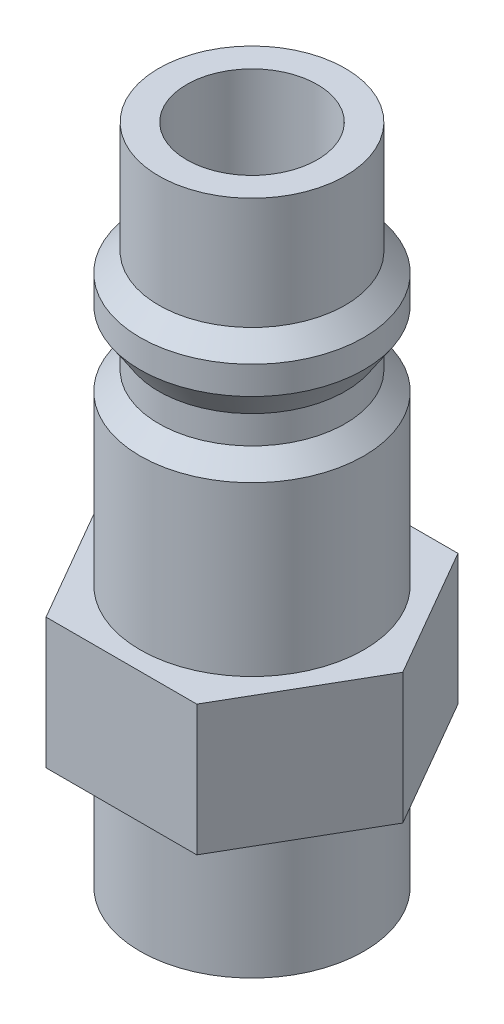
from build123d import *

# Parameters (mm, degrees)
AUFSATZ_LINEAR_AUSTRAGEN1_DEPTH = 7
SKIZZE4_R                       = 6
AUFSATZ_LINEAR_AUSTRAGEN3_DEPTH = 7
SKIZZE5_R                       = 3.5
SCHNITT_LINEAR_AUSTRAGEN1_DEPTH = 38.075373678


with BuildPart() as part:
    # Skizze1 → Aufsatz-Linear austragen1 (new body)
    with BuildSketch(Plane(origin=(0, 0, 0), x_dir=(1, 0, 0), z_dir=(0, 1, 0))):
        Polygon((8.082903769, 0), (4.041451884, 7), (-4.041451884, 7), (-8.082903769, 0), (-4.041451884, -7), (4.041451884, -7), align=None)
    extrude(amount=AUFSATZ_LINEAR_AUSTRAGEN1_DEPTH)

    # Skizze3 → Rotation1 (revolve)
    with BuildSketch(Plane.XY, mode=Mode.PRIVATE) as rotation1_sk:
        Polygon((0, 7), (-6, 7), (-6, 16), (-5, 17), (-5, 18.5), (-6, 20), (-6, 21.5), (-5, 22.5), (-5, 28.5), (0, 28.5), align=None)
    revolve(rotation1_sk.sketch.rotate(Axis((0, 0, 0), (0, 1, 0)), 270), axis=Axis((0, 0, 0), (0, 1, 0)))

    # Skizze4 → Aufsatz-Linear austragen3 (add)
    with BuildSketch(Plane.XZ):
        with Locations(Location((0, 0, 0), (0, 0, 270))):
            Circle(SKIZZE4_R)
    extrude(amount=AUFSATZ_LINEAR_AUSTRAGEN3_DEPTH)

    # Skizze5 → Schnitt-Linear austragen1 (cut, through all)
    with BuildSketch(Plane(origin=(0, 28.5, 0), x_dir=(1, 0, 0), z_dir=(0, 1, 0))):
        with Locations(Location((0, 0, 0), (0, 0, 270))):
            Circle(SKIZZE5_R)
    extrude(amount=-SCHNITT_LINEAR_AUSTRAGEN1_DEPTH, mode=Mode.SUBTRACT)


solid = part.part
